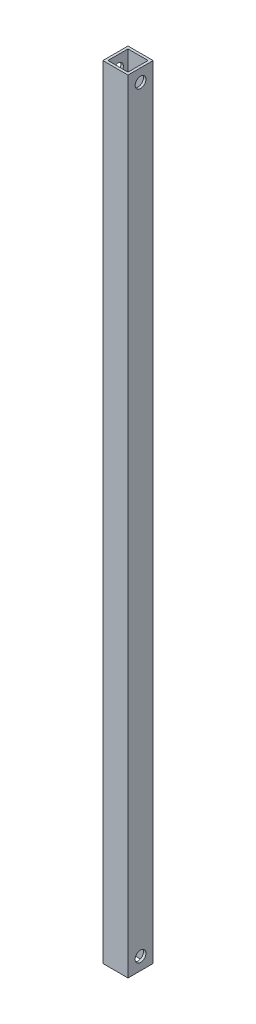
from build123d import *

# Parameters (mm, degrees)
SKETCH_1_W          = 10
SKETCH_1_H          = 10
SKETCH_1_W_2        = 8
SKETCH_1_H_2        = 8
EXTRUDE_1_DEPTH     = 311.018687128
SKETCH_2_R          = 2.15
CUT_EXTRUDE_1_DEPTH = 312.219574806


with BuildPart() as part:
    # ｽｹｯﾁ1 → 押し出し-薄板1 (new body)
    with BuildSketch(Plane(origin=(0, 0, 0), x_dir=(1, 0, 0), z_dir=(0, 1, 0))):
        Rectangle(SKETCH_1_W, SKETCH_1_H)
        Rectangle(SKETCH_1_W_2, SKETCH_1_H_2, mode=Mode.SUBTRACT)
    extrude(amount=EXTRUDE_1_DEPTH)

    # ｽｹｯﾁ2 → ｶｯﾄ - 押し出し1 (cut, through all)
    with BuildSketch(Plane(origin=(5, 0, 0), x_dir=(0, 0, -1), z_dir=(1, 0, 0))):
        with Locations((0, 5)):
            Circle(SKETCH_2_R)
        with Locations((0, 306.018687128)):
            Circle(SKETCH_2_R)
    extrude(amount=-CUT_EXTRUDE_1_DEPTH, mode=Mode.SUBTRACT)


solid = part.part
